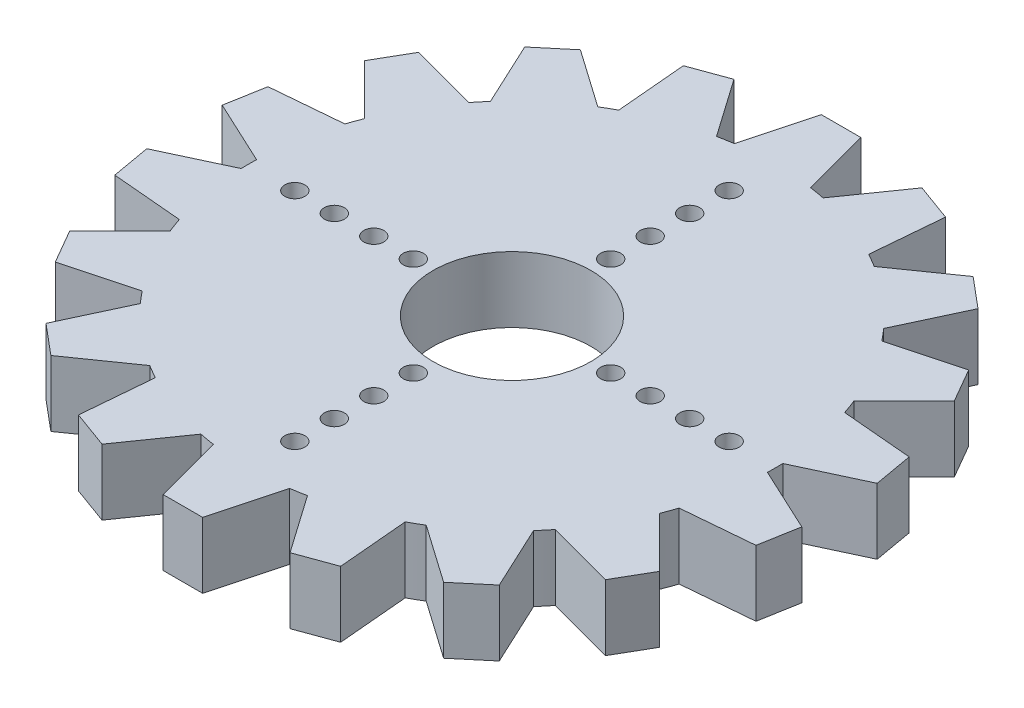
from build123d import *

# Parameters (mm, degrees)
SKETCH2_R           = 20
BOSS_EXTRUDE1_DEPTH = 5
BOSS_EXTRUDE2_DEPTH = 5
CIRPATTERN1_COUNT   = 18
SKETCH3_R           = 6
SKETCH3_R_2         = 0.762
CUT_EXTRUDE1_DEPTH  = 36.623693592
CIRPATTERN2_COUNT   = 4


with BuildPart() as part:
    # Sketch2 → Boss-Extrude1 (new body)
    with BuildSketch(Plane(origin=(0, 0, 0), x_dir=(1, 0, 0), z_dir=(0, 1, 0))):
        Circle(SKETCH2_R)
    extrude(amount=BOSS_EXTRUDE1_DEPTH)

    # Sketch2<3> → Boss-Extrude2 (add)
    with BuildSketch(Plane(origin=(0, 0, 0), x_dir=(1, 0, 0), z_dir=(0, 1, 0))):
        with BuildLine():
            ThreePointArc((-2.896233759, 19.789184673), (0, 20), (2.896233759, 19.789184673))
            Line((2.896233759, 19.789184673), (1.5, 25))
            Line((1.5, 25), (-1.5, 25))
            Line((-1.5, 25), (-2.896233759, 19.789184673))
        make_face()
    boss_extrude2 = extrude(amount=BOSS_EXTRUDE2_DEPTH)

    # CirPattern1: Boss-Extrude2 ×18 about axis
    cirpattern1_axis = Axis((0, 5, 0), (0, -1, 0))
    for i in range(1, CIRPATTERN1_COUNT):
        add(boss_extrude2.rotate(cirpattern1_axis, i * 360 / CIRPATTERN1_COUNT))

    # Sketch3 → Cut-Extrude1 (cut, through all)
    with BuildSketch(Plane(origin=(0, 0, 0), x_dir=(1, 0, 0), z_dir=(0, 1, 0))):
        Circle(SKETCH3_R)
        with Locations((7.5, 0)):
            Circle(SKETCH3_R_2)
        with Locations((10.5, 0)):
            Circle(SKETCH3_R_2)
        with Locations((13.5, 0)):
            Circle(SKETCH3_R_2)
        with Locations((16.5, 0)):
            Circle(SKETCH3_R_2)
    cut_extrude1 = extrude(amount=CUT_EXTRUDE1_DEPTH, mode=Mode.SUBTRACT)

    # CirPattern2: Cut-Extrude1 ×4 about axis
    cirpattern2_axis = Axis((0, 5, 0), (0, -1, 0))
    for i in range(1, CIRPATTERN2_COUNT):
        add(cut_extrude1.rotate(cirpattern2_axis, i * 360 / CIRPATTERN2_COUNT), mode=Mode.SUBTRACT)


solid = part.part
